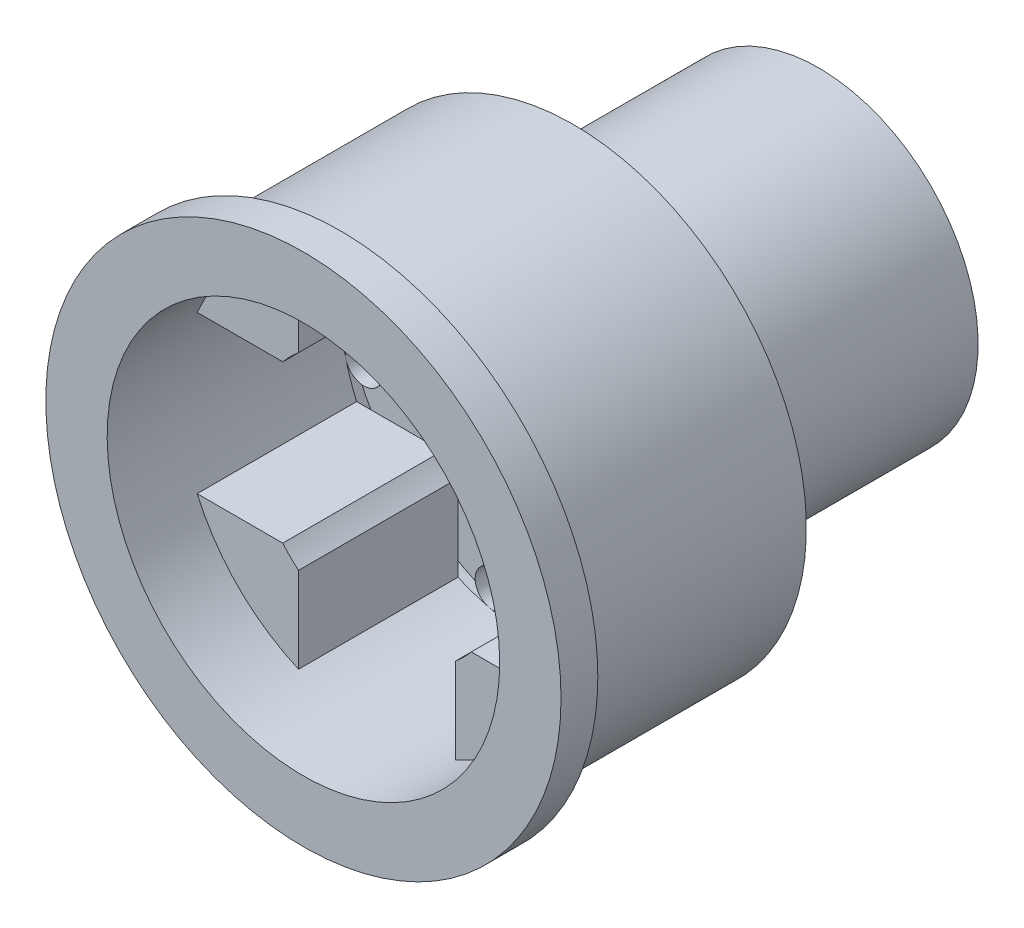
from build123d import *

# Parameters (mm, degrees)
SKETCH1_R         = 9.5
SKETCH1_R_2       = 8
EXTRUDE1_DEPTH    = 1.5
SKETCH2_R         = 10.5
SKETCH2_R_2       = 8
EXTRUDE2_DEPTH    = 1.5
EXTRUDE3_START    = 6.5
SKETCH3_R         = 9.5
EXTRUDE3_DEPTH    = 6.5
EXTRUDE4_START    = 1.5
SKETCH4_R         = 9.5
SKETCH4_R_2       = 5
EXTRUDE4_DEPTH    = 1.5
SKETCH5_R         = 5
EXTRUDE5_DEPTH    = 19.479718613
SKETCH6_R         = 0.75
EXTRUDE6_DEPTH    = 18.628102564
CIRPATTERN1_COUNT = 4
EXTRUDE7_START    = 10
SKETCH7_R         = 6.5
SKETCH7_R_2       = 5
EXTRUDE7_DEPTH    = 10
SKETCH8_R         = 6.5
SKETCH8_W         = 5
SKETCH8_H         = 5
EXTRUDE8_DEPTH    = 1.5


with BuildPart() as part:
    # Sketch1 → Extrude1 (new body)
    with BuildSketch(Plane.XY):
        Circle(SKETCH1_R)
        Circle(SKETCH1_R_2, mode=Mode.SUBTRACT)
    extrude(amount=EXTRUDE1_DEPTH)

    # Sketch2 → Extrude2 (add)
    with BuildSketch(Plane.XY.offset(1.5)):
        Circle(SKETCH2_R)
        Circle(SKETCH2_R_2, mode=Mode.SUBTRACT)
    extrude(amount=EXTRUDE2_DEPTH)

    # Sketch3 → Extrude3 (add)
    with BuildSketch(Plane(origin=(0, 0, 0), x_dir=(-1, 0, 0), z_dir=(0, 0, -1)).offset(EXTRUDE3_START)):
        Circle(SKETCH3_R)
        with BuildLine():
            Line((-7.332121112, 3.2), (-3.2, 3.2))
            Line((-3.2, 3.2), (-3.2, 7.332121112))
            ThreePointArc((-3.2, 7.332121112), (0, 8), (3.2, 7.332121112))
            Line((3.2, 7.332121112), (3.2, 3.2))
            Line((3.2, 3.2), (7.332121112, 3.2))
            ThreePointArc((7.332121112, 3.2), (8, 0), (7.332121112, -3.2))
            Line((7.332121112, -3.2), (3.2, -3.2))
            Line((3.2, -3.2), (3.2, -7.332121112))
            ThreePointArc((3.2, -7.332121112), (0, -8), (-3.2, -7.332121112))
            Line((-3.2, -7.332121112), (-3.2, -3.2))
            Line((-3.2, -3.2), (-7.332121112, -3.2))
            ThreePointArc((-7.332121112, -3.2), (-8, 0), (-7.332121112, 3.2))
        make_face(mode=Mode.SUBTRACT)
    extrude(amount=-EXTRUDE3_DEPTH)

    # Sketch4 → Extrude4 (add)
    with BuildSketch(Plane(origin=(0, 0, -6.5), x_dir=(-1, 0, 0), z_dir=(0, 0, -1)).offset(EXTRUDE4_START)):
        Circle(SKETCH4_R)
        with Locations(Location((0, 0, 0), (0, 0, 140.2081805))):
            Circle(SKETCH4_R_2, mode=Mode.SUBTRACT)
    extrude(amount=-EXTRUDE4_DEPTH)

    # Sketch5 → Extrude5 (cut, through all)
    with BuildSketch(Plane(origin=(0, 0, -8), x_dir=(-1, 0, 0), z_dir=(0, 0, -1))):
        with Locations(Location((0, 0, 0), (0, 0, 140.2081805))):
            Circle(SKETCH5_R)
    extrude(amount=-EXTRUDE5_DEPTH, mode=Mode.SUBTRACT)

    # Sketch6 → Extrude6 (cut, through all)
    with BuildSketch(Plane.XY.offset(-6.5)):
        with Locations((7.03562364, 1.75)):
            Circle(SKETCH6_R)
        with Locations(Location((7.03562364, -1.75, 0), (0, 0, 346.033020145))):
            Circle(SKETCH6_R)
    extrude6 = extrude(amount=-EXTRUDE6_DEPTH, mode=Mode.SUBTRACT)

    # CirPattern1: Extrude6 ×4 about axis
    cirpattern1_axis = Axis((0, 0, 0), (0, 0, 1))
    for i in range(1, CIRPATTERN1_COUNT):
        add(extrude6.rotate(cirpattern1_axis, i * 360 / CIRPATTERN1_COUNT), mode=Mode.SUBTRACT)

    # Sketch7 → Extrude7 (add)
    with BuildSketch(Plane(origin=(0, 0, -8), x_dir=(-1, 0, 0), z_dir=(0, 0, -1)).offset(EXTRUDE7_START)):
        with Locations(Location((0, 0, 0), (0, 0, 193.967860451))):
            Circle(SKETCH7_R)
        with Locations(Location((0, 0, 0), (0, 0, 140.2081805))):
            Circle(SKETCH7_R_2, mode=Mode.SUBTRACT)
    extrude(amount=-EXTRUDE7_DEPTH)

    # Sketch8 → Extrude8 (add)
    with BuildSketch(Plane(origin=(0, 0, -18), x_dir=(-1, 0, 0), z_dir=(0, 0, -1))):
        with Locations(Location((0, 0, 0), (0, 0, 193.967860451))):
            Circle(SKETCH8_R)
        Rectangle(SKETCH8_W, SKETCH8_H, mode=Mode.SUBTRACT)
    extrude(amount=-EXTRUDE8_DEPTH)


solid = part.part
